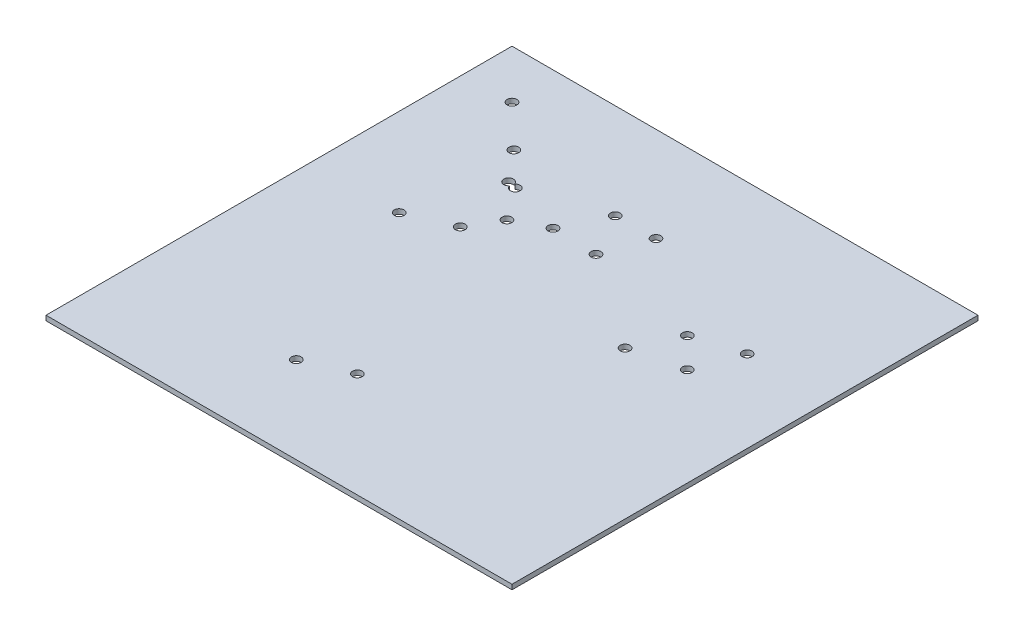
from build123d import *

# Parameters (mm, degrees)
SKETCH1_W           = 304.8
SKETCH1_H           = 304.8
SKETCH1_R           = 3.175
BOSS_EXTRUDE1_DEPTH = 3.175


with BuildPart() as part:
    # Sketch1 → Boss-Extrude1 (new body)
    with BuildSketch(Plane(origin=(0, 0, 0), x_dir=(1, 0, 0), z_dir=(0, 1, 0))):
        Rectangle(SKETCH1_W, SKETCH1_H)
        with Locations(Location((-45.357357994, -95.732151897, 0), (0, 0, 270))):
            Circle(SKETCH1_R, mode=Mode.SUBTRACT)
        with Locations(Location((-17.300370061, -83.822667101, 0), (0, 0, 270))):
            Circle(SKETCH1_R, mode=Mode.SUBTRACT)
        with Locations(Location((-94.980211312, 21.171964491, 0), (0, 0, 270))):
            Circle(SKETCH1_R, mode=Mode.SUBTRACT)
        with Locations(Location((-66.923223379, 33.081449287, 0), (0, 0, 270))):
            Circle(SKETCH1_R, mode=Mode.SUBTRACT)
        with BuildLine():
            ThreePointArc((-52.46406636, 52.33405969), (-56.890341235, 49.416023332), (-57.82780569, 54.634069505))
            ThreePointArc((-57.82780569, 54.634069505), (-54.387791485, 55.252096048), (-52.46406636, 52.33405969))
        make_face(mode=Mode.SUBTRACT)
        with BuildLine():
            ThreePointArc((-74.462224597, 72.114144094), (-79.780075115, 73.876298752), (-75.355842336, 77.31299593))
            ThreePointArc((-75.355842336, 77.31299593), (-74.456010488, 76.708234204), (-73.812117445, 75.835975154))
            Line((-73.812117445, 75.835975154), (-73.282380635, 75.32912819))
            ThreePointArc((-73.282380635, 75.32912819), (-69.805735318, 76.080726121), (-67.81330034, 73.134174752))
            ThreePointArc((-67.81330034, 73.134174752), (-70.679501662, 69.974227224), (-74.103233175, 72.519505386))
            ThreePointArc((-74.103233175, 72.519505386), (-74.274071701, 72.309157863), (-74.462224597, 72.114144094))
        make_face(mode=Mode.SUBTRACT)
        with Locations(Location((-35.851005438, 62.650447232, 0), (0, 0, 270))):
            Circle(SKETCH1_R, mode=Mode.SUBTRACT)
        with Locations(Location((-6.999045964, 61.958277868, 0), (0, 0, 270))):
            Circle(SKETCH1_R, mode=Mode.SUBTRACT)
        with BuildLine():
            ThreePointArc((-89.836471178, 94.205727762), (-90.064919809, 93.02316274), (-90.717390882, 92.010774323))
            ThreePointArc((-90.717390882, 92.010774323), (-95.958022547, 95.388292783), (-89.836471178, 94.205727762))
        make_face(mode=Mode.SUBTRACT)
        with Locations(Location((-120.65, 120.65, 0), (0, 0, 270))):
            Circle(SKETCH1_R, mode=Mode.SUBTRACT)
        with Locations(Location((-22.566006832, 90.082895392, 0), (0, 0, 270))):
            Circle(SKETCH1_R, mode=Mode.SUBTRACT)
        with Locations(Location((55.590488427, 18.367118544, 0), (0, 0, 270))):
            Circle(SKETCH1_R, mode=Mode.SUBTRACT)
        with Locations(Location((68.875487034, 45.799566703, 0), (0, 0, 270))):
            Circle(SKETCH1_R, mode=Mode.SUBTRACT)
        with Locations(Location((88.185465622, 26.427041553, 0), (0, 0, 270))):
            Circle(SKETCH1_R, mode=Mode.SUBTRACT)
        with Locations(Location((98.844836516, 54.982395029, 0), (0, 0, 270))):
            Circle(SKETCH1_R, mode=Mode.SUBTRACT)
        with Locations(Location((3.66032493, 90.513631344, 0), (0, 0, 270))):
            Circle(SKETCH1_R, mode=Mode.SUBTRACT)
    extrude(amount=BOSS_EXTRUDE1_DEPTH)


solid = part.part
